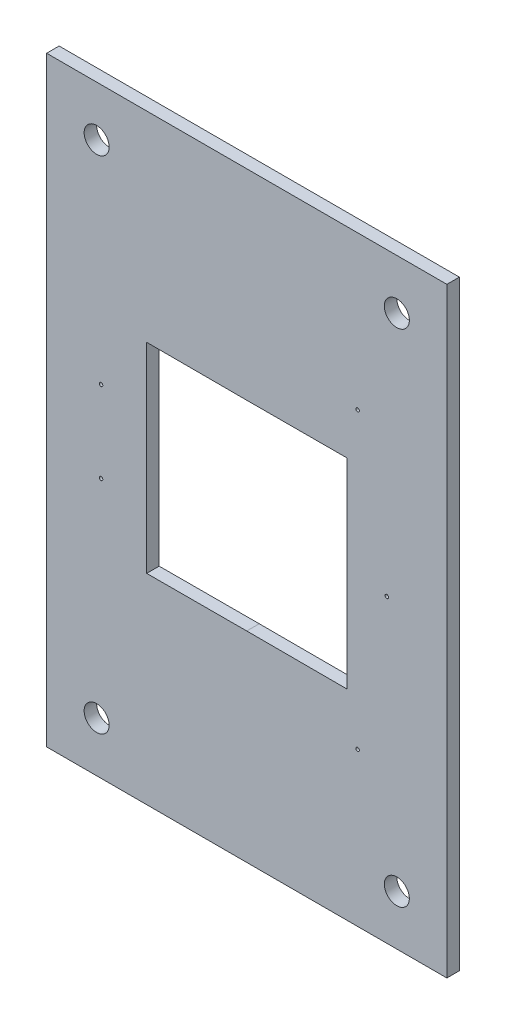
from build123d import *

# Parameters (mm, degrees)
SKETCH2_W           = 101.6
SKETCH2_H           = 152.490905348
SKETCH2_R           = 0.45
BOSS_EXTRUDE1_DEPTH = 3.175
SKETCH3_R           = 3.175
CUT_EXTRUDE1_DEPTH  = 10


with BuildPart() as part:
    # Sketch2 → Boss-Extrude1 (new body)
    with BuildSketch(Plane.XY):
        with Locations((339.823220758, -43.137414152)):
            Rectangle(SKETCH2_W, SKETCH2_H)
        with Locations((302.835020758, -32.804961478)):
            Circle(SKETCH2_R, mode=Mode.SUBTRACT)
        with Locations((367.9685278, -5.825779496)):
            Circle(SKETCH2_R, mode=Mode.SUBTRACT)
        with Locations(Location((302.835020758, -53.469866826, 0), (0, 0, 180))):
            Circle(SKETCH2_R, mode=Mode.SUBTRACT)
        with Locations((375.390273381, -43.137414152)):
            Circle(SKETCH2_R, mode=Mode.SUBTRACT)
        with Locations(Location((367.9685278, -80.449048807, 0), (0, 0, 180))):
            Circle(SKETCH2_R, mode=Mode.SUBTRACT)
        Polygon((365.223220758, -17.737414152), (339.823220758, -17.778276649), (314.423220758, -17.737414152), (314.423220758, -68.537414152), (339.823220758, -68.496551654), (365.223220758, -68.537414152), align=None, mode=Mode.SUBTRACT)
    extrude(amount=BOSS_EXTRUDE1_DEPTH)

    # Sketch3 → Cut-Extrude1 (cut)
    with BuildSketch(Plane.XY.offset(3.175)):
        with Locations((377.923220758, 20.408038522)):
            Circle(SKETCH3_R)
        with Locations(Location((301.723220758, 20.408038522, 0), (0, 0, 180))):
            Circle(SKETCH3_R)
        with Locations((301.723220758, -106.682866826)):
            Circle(SKETCH3_R)
        with Locations(Location((377.923220758, -106.682866826, 0), (0, 0, 180))):
            Circle(SKETCH3_R)
    extrude(amount=-CUT_EXTRUDE1_DEPTH, mode=Mode.SUBTRACT)


solid = part.part
